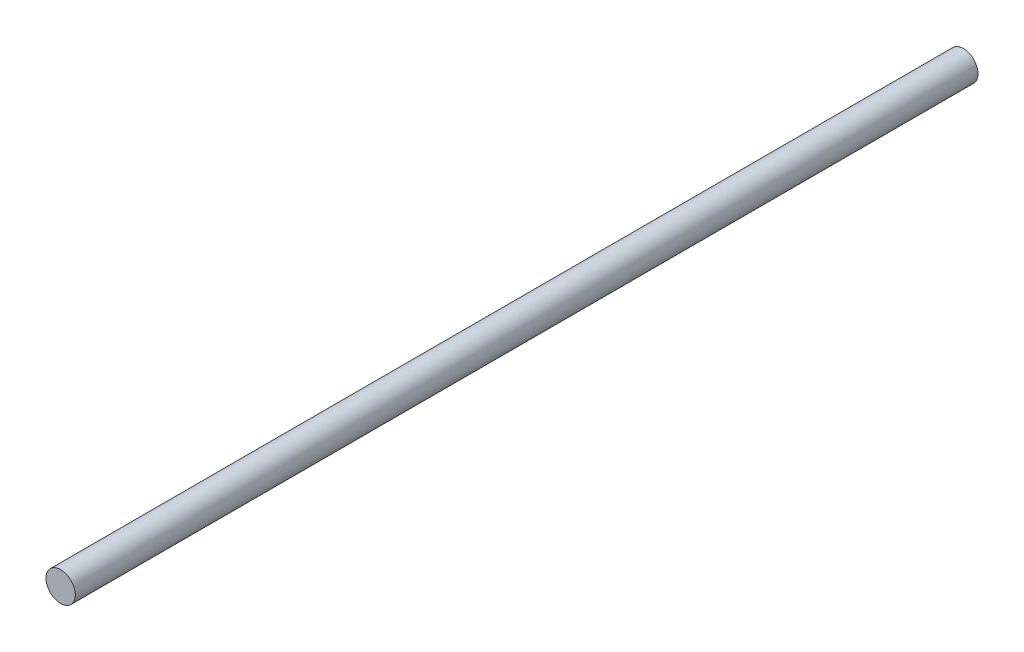
from build123d import *

# Parameters (mm, degrees)
SKETCH1_R           = 3.25
BOSS_EXTRUDE1_DEPTH = 200


with BuildPart() as part:
    # Sketch1 → Boss-Extrude1 (new body)
    with BuildSketch(Plane.XY):
        with Locations((3.947238397, -0.768672741)):
            Circle(SKETCH1_R)
    extrude(amount=BOSS_EXTRUDE1_DEPTH)


solid = part.part
